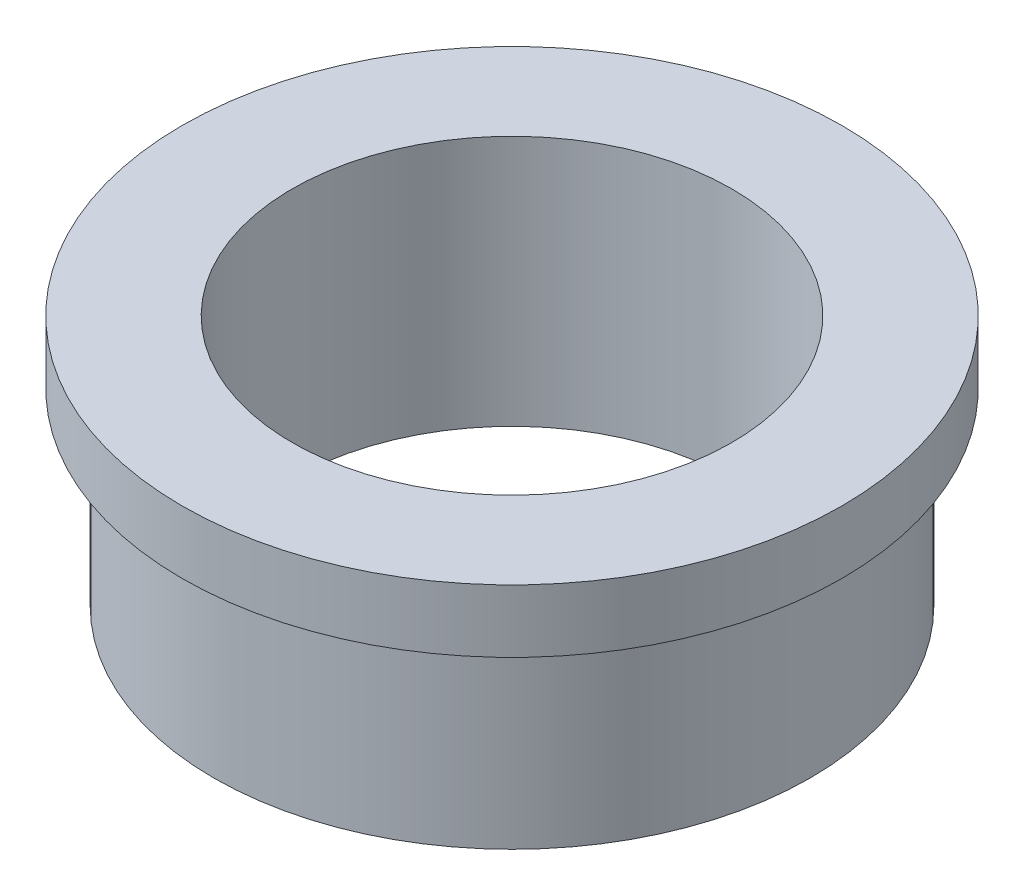
from build123d import *


with BuildPart() as part:
    # Sketch1 → Revolve1 (revolve)
    with BuildSketch(Plane.XY, mode=Mode.PRIVATE) as revolve1_sk:
        Polygon((-7, 0), (-9.5, 0), (-9.5, 6), (-10.5, 6), (-10.5, 8), (-7, 8), align=None)
    revolve(revolve1_sk.sketch.rotate(Axis((0, 0, 0), (0, 1, 0)), 270), axis=Axis((0, 0, 0), (0, 1, 0)))


solid = part.part
